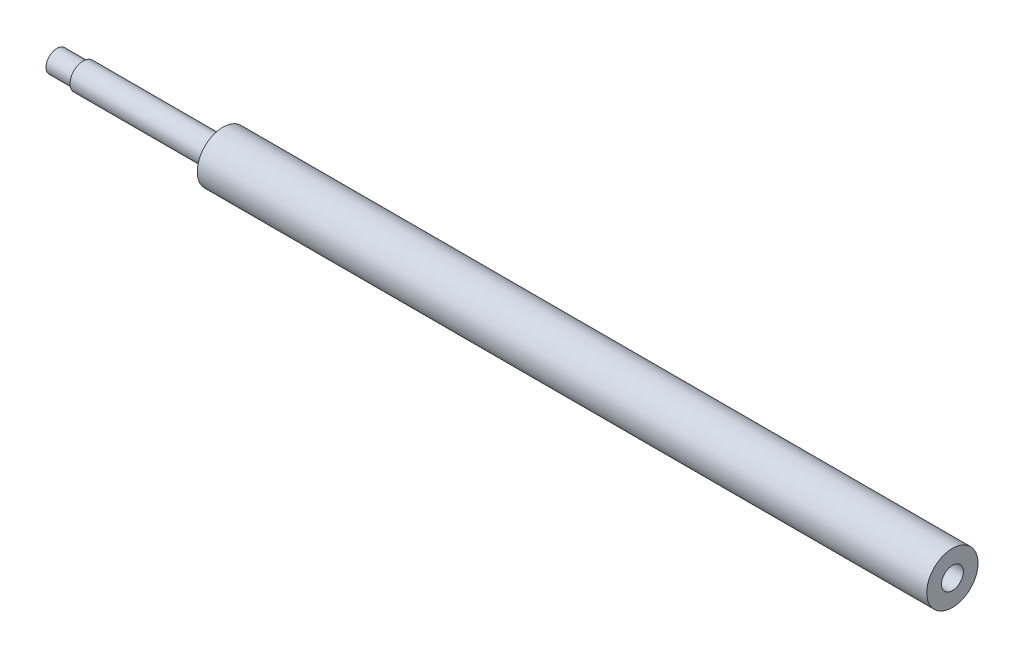
from build123d import *

# Parameters (mm, degrees)
PER_AGE1_D     = 5
PER_AGE1_DEPTH = 20
PER_AGE1_TIP   = 1.502151548


with BuildPart() as part:
    # Esquisse1 → Base-Révolution (revolve)
    with BuildSketch(Plane.XY, mode=Mode.PRIVATE) as base_r_volution_sk:
        Polygon((0, 0), (0, 2.5), (6, 2.5), (6, 3), (38, 3), (38, 5.875), (205, 5.875), (205, 0), align=None)
    revolve(base_r_volution_sk.sketch.rotate(Axis((0, 0, 0), (1, 0, 0)), 90), axis=Axis((0, 0, 0), (1, 0, 0)))

    # Perçage1
    with Locations(Plane(origin=(205, 0, 0), x_dir=(0, 0, -1), z_dir=(1, 0, 0))):
        with Locations((0, 0)):
            Hole(PER_AGE1_D / 2, depth=PER_AGE1_DEPTH)
            with Locations((0, 0, -(PER_AGE1_DEPTH + PER_AGE1_TIP / 2))):  # 118° drill point
                Cone(0, PER_AGE1_D / 2, PER_AGE1_TIP, mode=Mode.SUBTRACT)


solid = part.part
